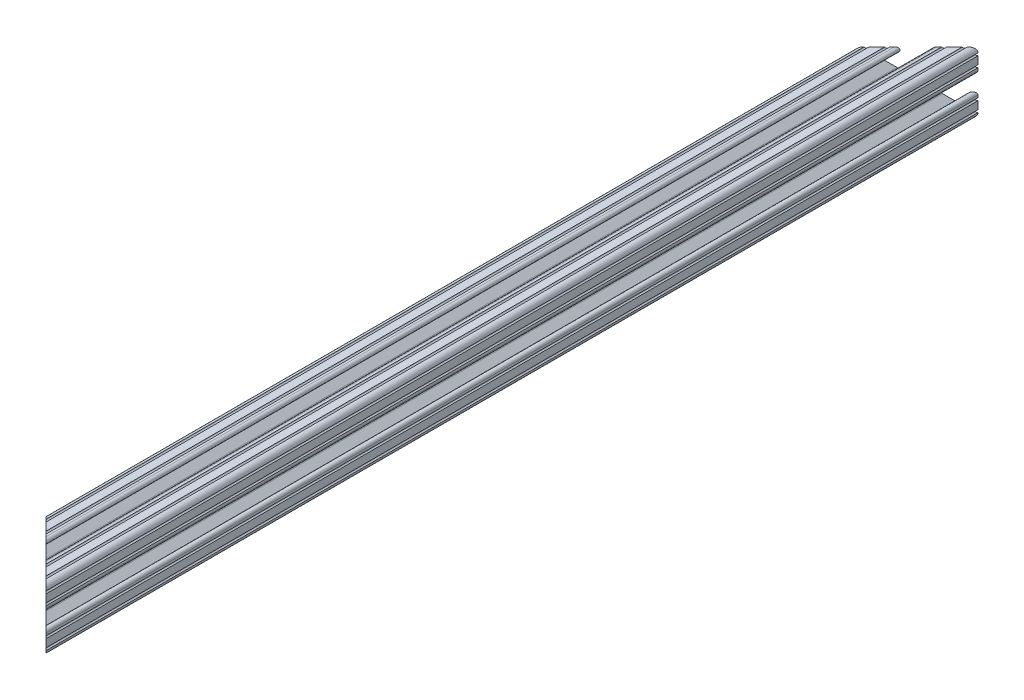
from build123d import *

# Parameters (mm, degrees)
SKETCH1_R               = 2.6035
BOSS_EXTRUDE1_DEPTH     = 381
CUT_EXTRUDE2_DEPTH      = 280.9766776
CUT_EXTRUDE2_DEPTH_BACK = 280.9766776
CUT_EXTRUDE3_DEPTH      = 280.9766776
CUT_EXTRUDE3_DEPTH_BACK = 280.9766776


with BuildPart() as part:
    # Sketch1 → Boss-Extrude1 (new body)
    with BuildSketch(Plane(origin=(0, 0, -101.6), x_dir=(-1, 0, 0), z_dir=(0, 0, -1))):
        with BuildLine():
            Line((12.7, -9.5504), (12.7, -6.3330836))
            ThreePointArc((12.7, -6.3330836), (12.192, -5.8250836), (12.7, -5.3170836))
            Line((12.7, -5.3170836), (12.7, -4.3434))
            ThreePointArc((12.7, -4.3434), (11.5951, -3.2385), (10.4902, -4.3434))
            Line((10.4902, -4.3434), (10.4902, -6.474794456))
            ThreePointArc((10.4902, -6.474794456), (9.863006367, -7.413456061), (8.75577951, -7.193214945))
            Line((8.75577951, -7.193214945), (5.42573597, -3.863171405))
            ThreePointArc((5.42573597, -3.863171405), (4.737482484, -2.833127272), (4.4958, -1.618107374))
            Line((4.4958, -1.618107374), (4.4958, 1.618107374))
            ThreePointArc((4.4958, 1.618107374), (4.737482484, 2.833127272), (5.42573597, 3.863171405))
            Line((5.42573597, 3.863171405), (8.75577951, 7.193214945))
            ThreePointArc((8.75577951, 7.193214945), (9.863006367, 7.413456061), (10.4902, 6.474794456))
            Line((10.4902, 6.474794456), (10.4902, 4.343399971))
            ThreePointArc((10.4902, 4.343399971), (11.5951, 3.238499971), (12.7, 4.343399971))
            Line((12.7, 4.343399971), (12.7, 5.3170836))
            ThreePointArc((12.7, 5.3170836), (12.192, 5.8250836), (12.7, 6.3330836))
            Line((12.7, 6.3330836), (12.7, 9.5504))
            ThreePointArc((12.7, 9.5504), (12.192000006, 10.058323491), (12.699846982, 10.566399977))
            ThreePointArc((12.699846982, 10.566399977), (12.082522516, 12.082522516), (10.566399977, 12.699846982))
            ThreePointArc((10.566399977, 12.699846982), (10.058323491, 12.192000006), (9.5504, 12.7))
            Line((9.5504, 12.7), (6.3330836, 12.7))
            ThreePointArc((6.3330836, 12.7), (5.8250836, 12.192), (5.3170836, 12.7))
            Line((5.3170836, 12.7), (4.3434, 12.7))
            ThreePointArc((4.3434, 12.7), (3.2385, 11.5951), (4.3434, 10.4902))
            Line((4.3434, 10.4902), (6.474794456, 10.4902))
            ThreePointArc((6.474794456, 10.4902), (7.413456061, 9.863006367), (7.193214945, 8.75577951))
            Line((7.193214945, 8.75577951), (3.863171405, 5.42573597))
            ThreePointArc((3.863171405, 5.42573597), (2.833127272, 4.737482484), (1.618107374, 4.4958))
            Line((1.618107374, 4.4958), (-1.618107374, 4.4958))
            ThreePointArc((-1.618107374, 4.4958), (-2.833127272, 4.737482484), (-3.863171405, 5.42573597))
            Line((-3.863171405, 5.42573597), (-7.193214945, 8.75577951))
            ThreePointArc((-7.193214945, 8.75577951), (-7.413456061, 9.863006367), (-6.474794456, 10.4902))
            Line((-6.474794456, 10.4902), (-4.343399971, 10.4902))
            ThreePointArc((-4.343399971, 10.4902), (-3.238499971, 11.5951), (-4.343399971, 12.7))
            Line((-4.343399971, 12.7), (-5.3170836, 12.7))
            ThreePointArc((-5.3170836, 12.7), (-5.8250836, 12.192), (-6.3330836, 12.7))
            Line((-6.3330836, 12.7), (-9.5504, 12.7))
            ThreePointArc((-9.5504, 12.7), (-10.058323491, 12.192000006), (-10.566399977, 12.699846982))
            ThreePointArc((-10.566399977, 12.699846982), (-12.082522516, 12.082522516), (-12.699846982, 10.566399977))
            ThreePointArc((-12.699846982, 10.566399977), (-12.192000006, 10.058323491), (-12.7, 9.5504))
            Line((-12.7, 9.5504), (-12.7, 6.3330836))
            ThreePointArc((-12.7, 6.3330836), (-12.192, 5.8250836), (-12.7, 5.3170836))
            Line((-12.7, 5.3170836), (-12.7, 4.3434))
            ThreePointArc((-12.7, 4.3434), (-11.5951, 3.2385), (-10.4902, 4.3434))
            Line((-10.4902, 4.3434), (-10.4902, 6.474794456))
            ThreePointArc((-10.4902, 6.474794456), (-9.863006367, 7.413456061), (-8.75577951, 7.193214945))
            Line((-8.75577951, 7.193214945), (-5.42573597, 3.863171405))
            ThreePointArc((-5.42573597, 3.863171405), (-4.737482484, 2.833127272), (-4.4958, 1.618107374))
            Line((-4.4958, 1.618107374), (-4.4958, -1.618107374))
            ThreePointArc((-4.4958, -1.618107374), (-4.737482484, -2.833127272), (-5.42573597, -3.863171405))
            Line((-5.42573597, -3.863171405), (-8.75577951, -7.193214945))
            ThreePointArc((-8.75577951, -7.193214945), (-9.863006367, -7.413456061), (-10.4902, -6.474794456))
            Line((-10.4902, -6.474794456), (-10.4902, -4.343399971))
            ThreePointArc((-10.4902, -4.343399971), (-11.5951, -3.238499971), (-12.7, -4.343399971))
            Line((-12.7, -4.343399971), (-12.7, -5.3170836))
            ThreePointArc((-12.7, -5.3170836), (-12.192, -5.8250836), (-12.7, -6.3330836))
            Line((-12.7, -6.3330836), (-12.7, -9.5504))
            ThreePointArc((-12.7, -9.5504), (-12.192000006, -10.058323491), (-12.699846982, -10.566399977))
            ThreePointArc((-12.699846982, -10.566399977), (-12.082522516, -12.082522516), (-10.566399977, -12.699846982))
            ThreePointArc((-10.566399977, -12.699846982), (-10.058323491, -12.192000006), (-9.5504, -12.7))
            Line((-9.5504, -12.7), (-6.3330836, -12.7))
            ThreePointArc((-6.3330836, -12.7), (-5.8250836, -12.192), (-5.3170836, -12.7))
            Line((-5.3170836, -12.7), (-4.3434, -12.7))
            ThreePointArc((-4.3434, -12.7), (-3.2385, -11.5951), (-4.3434, -10.4902))
            Line((-4.3434, -10.4902), (-6.474794456, -10.4902))
            ThreePointArc((-6.474794456, -10.4902), (-7.413456061, -9.863006367), (-7.193214945, -8.75577951))
            Line((-7.193214945, -8.75577951), (-3.863171405, -5.42573597))
            ThreePointArc((-3.863171405, -5.42573597), (-2.833127272, -4.737482484), (-1.618107374, -4.4958))
            Line((-1.618107374, -4.4958), (1.618107374, -4.4958))
            ThreePointArc((1.618107374, -4.4958), (2.833127272, -4.737482484), (3.863171405, -5.42573597))
            Line((3.863171405, -5.42573597), (7.193214945, -8.75577951))
            ThreePointArc((7.193214945, -8.75577951), (7.413456061, -9.863006367), (6.474794456, -10.4902))
            Line((6.474794456, -10.4902), (4.343399971, -10.4902))
            ThreePointArc((4.343399971, -10.4902), (3.238499971, -11.5951), (4.343399971, -12.7))
            Line((4.343399971, -12.7), (5.3170836, -12.7))
            ThreePointArc((5.3170836, -12.7), (5.8250836, -12.192), (6.3330836, -12.7))
            Line((6.3330836, -12.7), (9.5504, -12.7))
            ThreePointArc((9.5504, -12.7), (10.058323491, -12.192000006), (10.566399977, -12.699846982))
            ThreePointArc((10.566399977, -12.699846982), (12.082522516, -12.082522516), (12.699846982, -10.566399977))
            ThreePointArc((12.699846982, -10.566399977), (12.192000006, -10.058323491), (12.7, -9.5504))
        make_face()
        with Locations(Location((0, 0, 0), (0, 0, 180))):
            Circle(SKETCH1_R, mode=Mode.SUBTRACT)
    extrude(amount=-BOSS_EXTRUDE1_DEPTH)

    # Sketch2 → Cut-Extrude2 (cut, two sides: drawn at the far end of the back side and taken through both)
    with BuildSketch(Plane(origin=(0, 0, 0), x_dir=(1, 0, 0), z_dir=(0, 1, 0)).offset(-CUT_EXTRUDE2_DEPTH_BACK)):
        Polygon((12.7, 101.6), (-12.7, 101.6), (-12.7, 76.2), align=None)
    extrude(amount=CUT_EXTRUDE2_DEPTH + CUT_EXTRUDE2_DEPTH_BACK, mode=Mode.SUBTRACT)

    # Sketch4 → Cut-Extrude3 (cut, two sides: drawn at the far end of the back side and taken through both)
    with BuildSketch(Plane(origin=(0, 0, 0), x_dir=(1, 0, 0), z_dir=(0, 1, 0)).offset(-CUT_EXTRUDE3_DEPTH_BACK)):
        Polygon((-12.7, -279.4), (12.7, -279.4), (-12.7, -254), align=None)
    extrude(amount=CUT_EXTRUDE3_DEPTH + CUT_EXTRUDE3_DEPTH_BACK, mode=Mode.SUBTRACT)


solid = part.part
